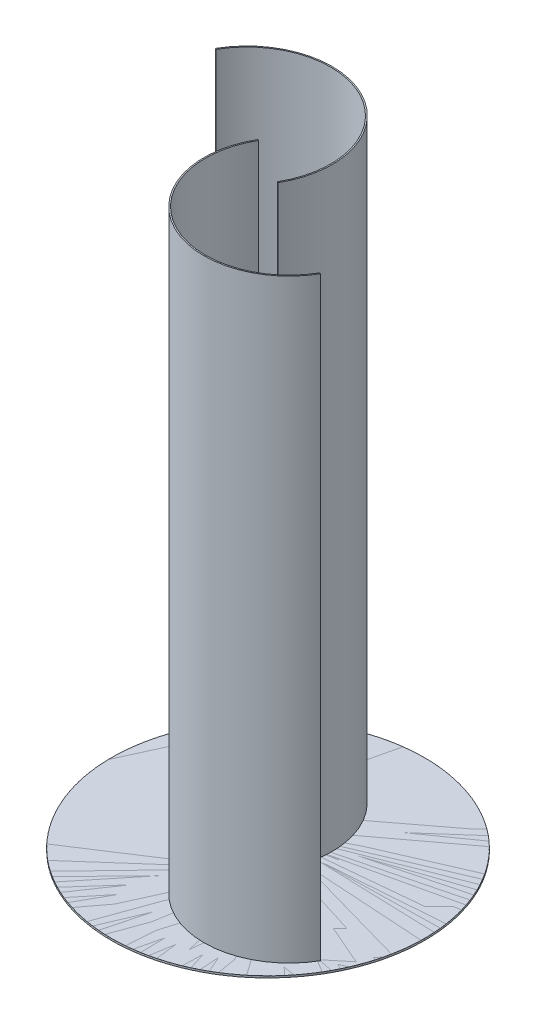
from build123d import *

# Parameters (mm, degrees)
CROQUIS1_R              = 250
SALIENTE_EXTRUIR1_DEPTH = 3
SALIENTE_EXTRUIR2_DEPTH = 950
MATRIZC1_COUNT          = 2


with BuildPart() as part:
    # Croquis1 → Saliente-Extruir1 (new body)
    with BuildSketch(Plane(origin=(0, 0, 0), x_dir=(1, 0, 0), z_dir=(0, 1, 0))):
        with Locations(Location((0, 0, 0), (0, 0, 270))):
            Circle(CROQUIS1_R)
    extrude(amount=SALIENTE_EXTRUIR1_DEPTH)

    # Croquis2 → Saliente-Extruir2 (add)
    with BuildSketch(Plane(origin=(0, 3, 0), x_dir=(1, 0, 0), z_dir=(0, 1, 0))):
        with BuildLine():
            Line((-197.689980809, 114.136363636), (-195.957930002, 113.136363636))
            ThreePointArc((-195.957930002, 113.136363636), (-12.910525895, 162.183767743), (36.136878212, -20.863636364))
            Line((36.136878212, -20.863636364), (37.86892902, -21.863636364))
            ThreePointArc((37.86892902, -21.863636364), (-11.910525895, 163.915818551), (-197.689980809, 114.136363636))
        make_face()
    extrude(amount=SALIENTE_EXTRUIR2_DEPTH)


with BuildPart() as matrizc1_1:
    # MatrizC1: pattern copy
    add(part.part.rotate(Axis((0, 0, 0), (0, 1, 0)), 1 * 360 / MATRIZC1_COUNT))


solid = Compound([part.part, matrizc1_1.part])
